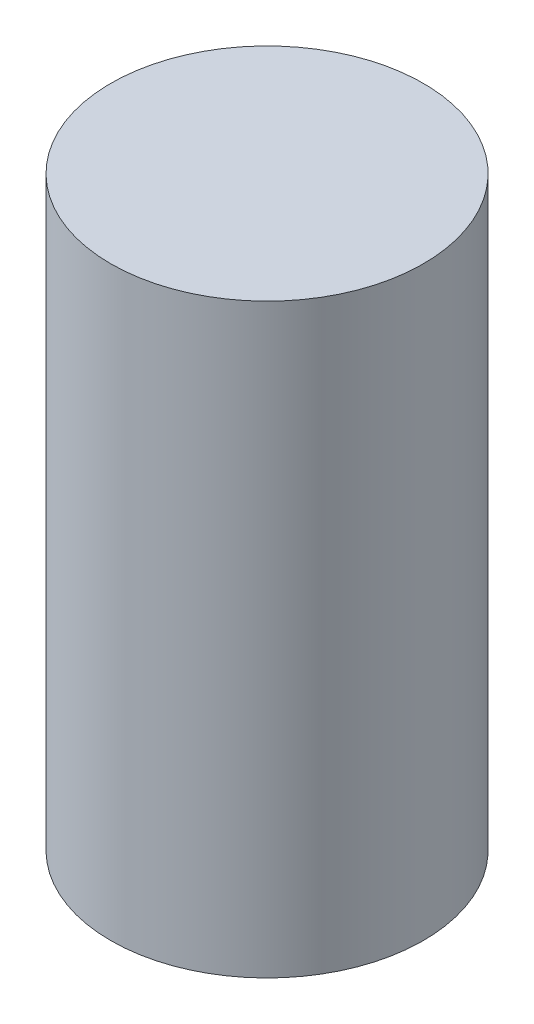
from build123d import *

# Parameters (mm, degrees)
SKETCH1_R           = 4
BOSS_EXTRUDE1_DEPTH = 15


with BuildPart() as part:
    # Sketch1 → Boss-Extrude1 (new body)
    with BuildSketch(Plane(origin=(0, 0, 0), x_dir=(1, 0, 0), z_dir=(0, 1, 0))):
        with Locations(Location((0, 0, 0), (0, 0, 270))):
            Circle(SKETCH1_R)
    extrude(amount=BOSS_EXTRUDE1_DEPTH)


solid = part.part
